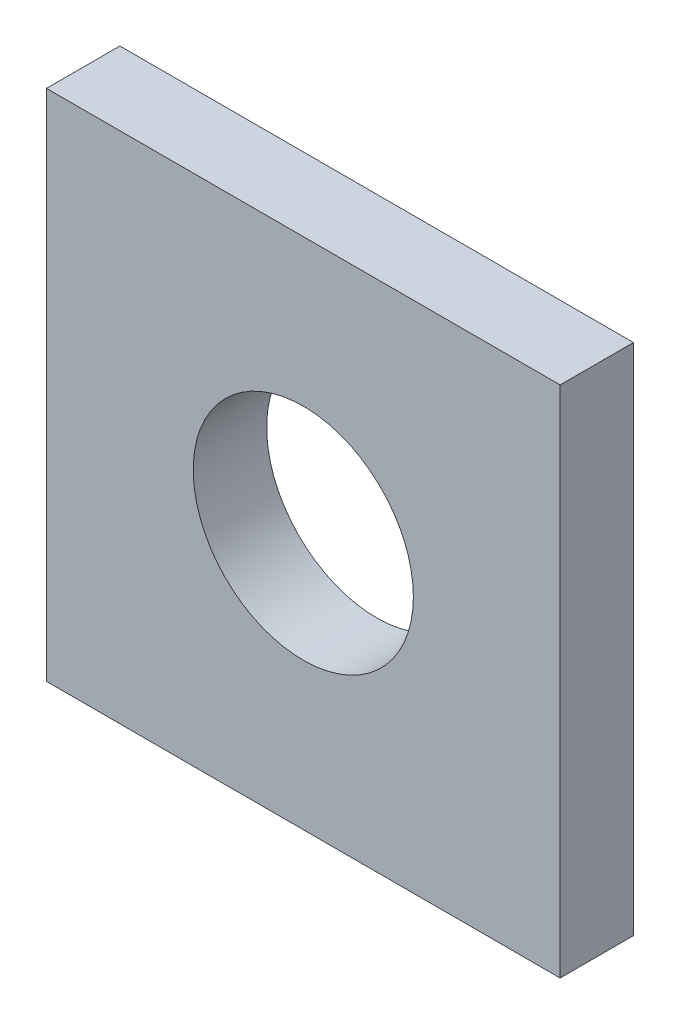
from build123d import *

# Parameters (mm, degrees)
SKETCH_1_W      = 70
SKETCH_1_H      = 70
SKETCH_1_R      = 15
EXTRUDE_1_DEPTH = 10
SCALE_1_SCALE   = 0.6


with BuildPart() as part:
    # 草图1 → 凸台-拉伸1 (new body)
    with BuildSketch(Plane.XY):
        Rectangle(SKETCH_1_W, SKETCH_1_H)
        Circle(SKETCH_1_R, mode=Mode.SUBTRACT)
    extrude(amount=EXTRUDE_1_DEPTH)


with BuildPart() as part_1:
    # 缩放比例1: scaled about (0, 0, 0)
    add(part.part.scale(SCALE_1_SCALE))


solid = part_1.part
